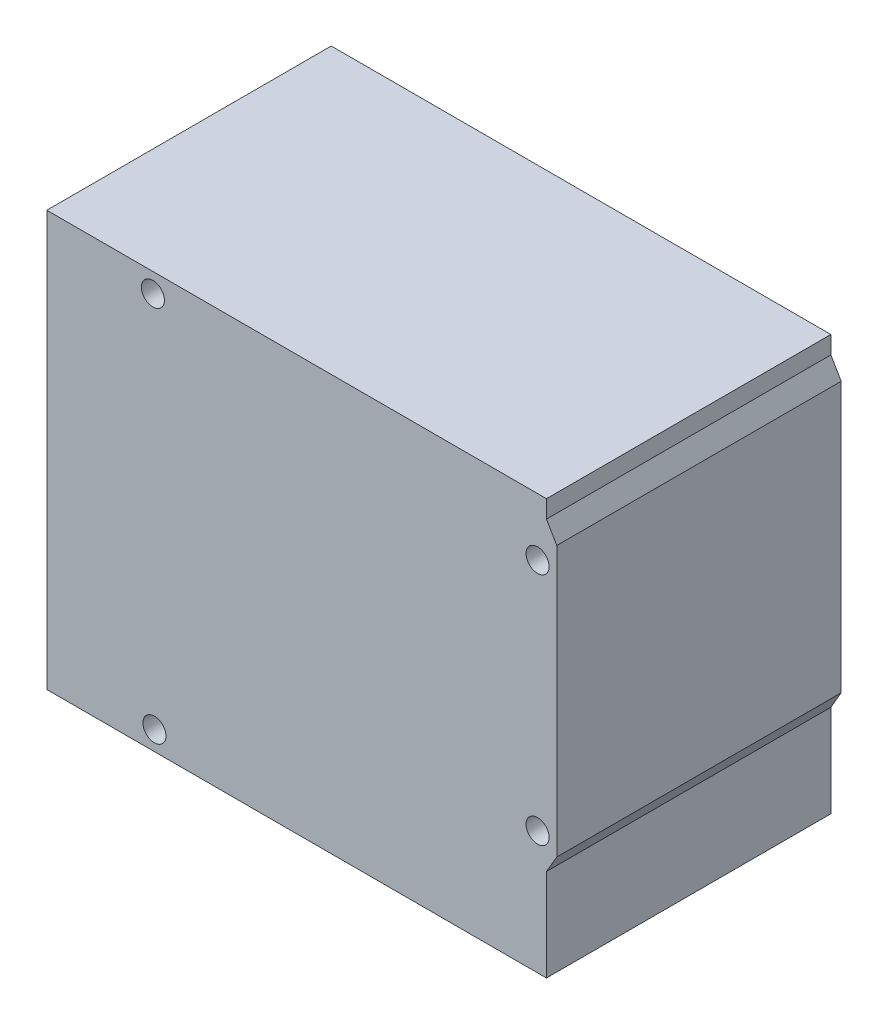
from build123d import *

# Parameters (mm, degrees)
SKETCH1_R           = 1.5
BOSS_EXTRUDE1_DEPTH = 37


with BuildPart() as part:
    # Sketch1 → Boss-Extrude1 (new body)
    with BuildSketch(Plane.XY):
        Polygon((0, 0), (0, 54), (65, 54), (65, 51.7), (66.341321595, 49.4), (66.341321595, 14.3), (65, 12), (65, 0), align=None)
        with Locations((13.8, 51.5)):
            Circle(SKETCH1_R, mode=Mode.SUBTRACT)
        with Locations((63.841321595, 46.5)):
            Circle(SKETCH1_R, mode=Mode.SUBTRACT)
        with Locations((63.841321595, 16)):
            Circle(SKETCH1_R, mode=Mode.SUBTRACT)
        with Locations((14, 2.5)):
            Circle(SKETCH1_R, mode=Mode.SUBTRACT)
    extrude(amount=BOSS_EXTRUDE1_DEPTH)


solid = part.part
